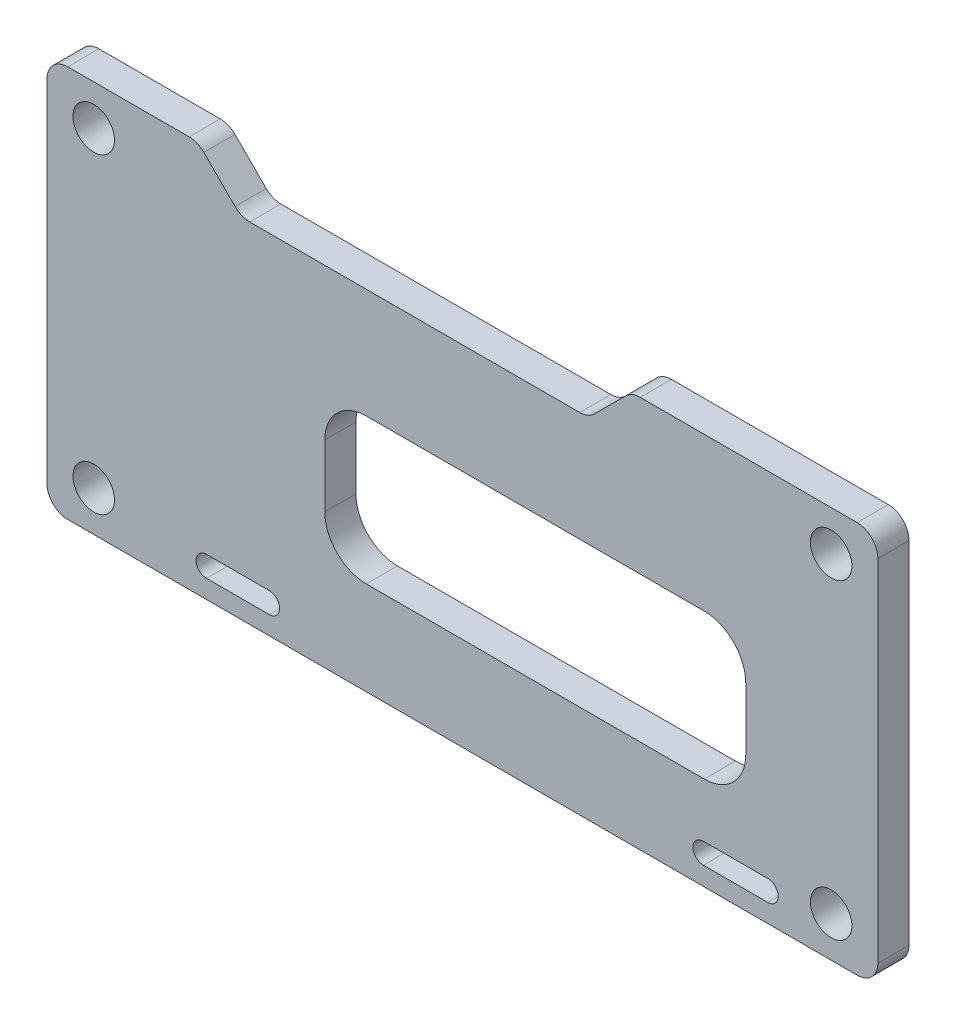
from build123d import *

# Parameters (mm, degrees)
SKETCH_1_W          = 40
SKETCH_1_H          = 18.871619184
SKETCH_1_R          = 1
EXTRUDE_1_DEPTH     = 1.5
SKETCH_2_W          = 20.265588098
SKETCH_2_H          = 7.002088202
CUT_EXTRUDE_1_DEPTH = 1.5
FILLET_1_R          = 1
FILLET_2_R          = 1
FILLET_3_R          = 2


with BuildPart() as part:
    # 草图1 → 凸台-拉伸1 (new body)
    with BuildSketch(Plane.XY):
        with Locations((-3.988440653, 2.400990099)):
            Rectangle(SKETCH_1_W, SKETCH_1_H)
        with Locations((-21.738440653, 9.900990099)):
            Circle(SKETCH_1_R, mode=Mode.SUBTRACT)
        with Locations((-21.738440653, -5.099009901)):
            Circle(SKETCH_1_R, mode=Mode.SUBTRACT)
        with Locations((13.761559347, -5.099009901)):
            Circle(SKETCH_1_R, mode=Mode.SUBTRACT)
        with Locations((13.761559347, 9.900990099)):
            Circle(SKETCH_1_R, mode=Mode.SUBTRACT)
    extrude(amount=EXTRUDE_1_DEPTH)

    # 草图2 → 切除-拉伸1 (cut)
    with BuildSketch(Plane.XY.offset(1.5)):
        Polygon((-16.728608447, 11.836799691), (-14.639805099, 9.747996342), (2.071462084, 9.747996342), (5.519738876, 13.196273134), (-14.871851344, 13.196273134), align=None)
        with Locations((-0.480960338, 0.9646533)):
            Rectangle(SKETCH_2_W, SKETCH_2_H)
        with BuildLine():
            Line((-16.310435566, -5.15021554), (-13.288801442, -5.15021554))
            ThreePointArc((-13.288801442, -5.15021554), (-12.788801442, -5.65021554), (-13.288801442, -6.15021554))
            Line((-13.288801442, -6.15021554), (-16.310435566, -6.15021554))
            ThreePointArc((-16.310435566, -6.15021554), (-16.810435566, -5.65021554), (-16.310435566, -5.15021554))
        make_face()
        with BuildLine():
            Line((7.610434302, -5.15021554), (10.713575026, -5.15021554))
            ThreePointArc((10.713575026, -5.15021554), (11.213575026, -5.65021554), (10.713575026, -6.15021554))
            Line((10.713575026, -6.15021554), (7.610434302, -6.15021554))
            ThreePointArc((7.610434302, -6.15021554), (7.110434302, -5.65021554), (7.610434302, -5.15021554))
        make_face()
    extrude(amount=-CUT_EXTRUDE_1_DEPTH, mode=Mode.SUBTRACT)

    # 圆角1
    fillet_1_edges = [part.edges().sort_by_distance(p)[0] for p in [
        (4.160265432, 11.836799691, 0.75),
        (-16.728608447, 11.836799691, 0.75),
        (2.071462084, 9.747996342, 0.75),
        (-14.639805099, 9.747996342, 0.75),
    ]]
    fillet(fillet_1_edges, radius=FILLET_1_R)

    # 圆角2
    fillet_2_edges = [part.edges().sort_by_distance(p)[0] for p in [
        (16.011559347, -7.034819493, 0.75),
        (-23.988440653, -7.034819493, 0.75),
        (-23.988440653, 11.836799691, 0.75),
        (16.011559347, 11.836799691, 0.75),
    ]]
    fillet(fillet_2_edges, radius=FILLET_2_R)

    # 圆角3
    fillet_3_edges = [part.edges().sort_by_distance(p)[0] for p in [
        (9.651833711, 4.465697401, 0.75),
        (9.651833711, -2.536390801, 0.75),
        (-10.613754387, -2.536390801, 0.75),
        (-10.613754387, 4.465697401, 0.75),
    ]]
    fillet(fillet_3_edges, radius=FILLET_3_R)


solid = part.part
